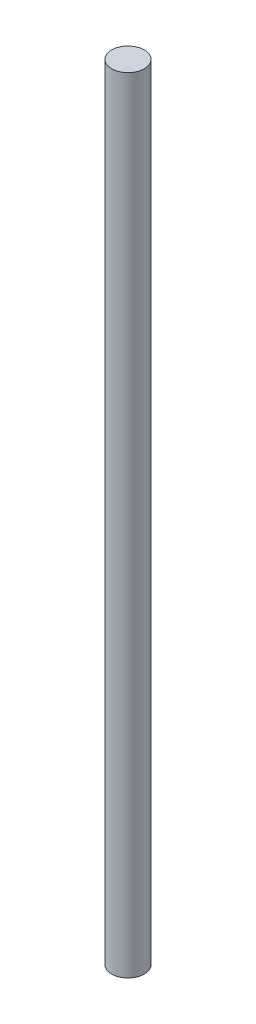
from build123d import *

# Parameters (mm, degrees)
SKETCH1_R           = 12.5
BOSS_EXTRUDE1_DEPTH = 300


with BuildPart() as part:
    # Sketch1 → Boss-Extrude1 (new, symmetric)
    with BuildSketch(Plane(origin=(0, 0, 0), x_dir=(1, 0, 0), z_dir=(0, 1, 0))):
        with Locations(Location((0, 0, 0), (0, 0, 270))):
            Circle(SKETCH1_R)
    extrude(amount=BOSS_EXTRUDE1_DEPTH, both=True)


solid = part.part
